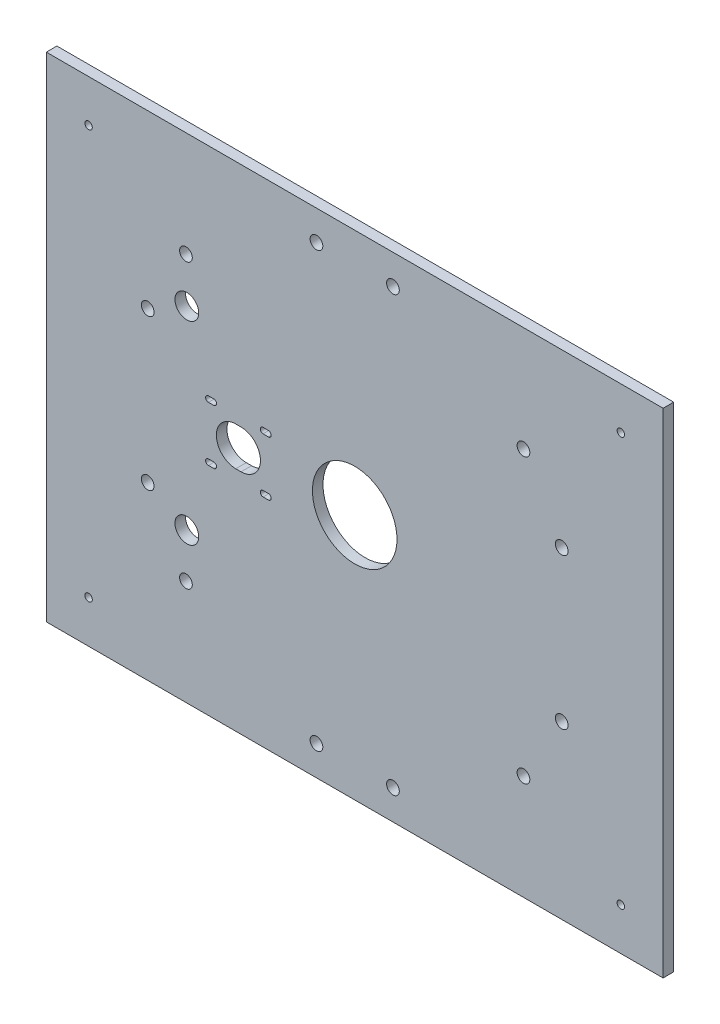
from build123d import *

# Parameters (mm, degrees)
ESBO_O1_W                    = 350
ESBO_O1_H                    = 280
RESSALTO_EXTRUS_O1_DEPTH     = 6
ESBO_O2_R                    = 24
CORTE_EXTRUS_O1_DEPTH        = 225.189651858
FUROS_GUIA_COM_8_0MM1_D      = 8
FURO_DE_DI_METRO_3_2_3_2_1_D = 3.2
FURO_COM_FOLGA_DE_M121_D     = 13.5
ESBO_O9_R                    = 3.6
CORTE_EXTRUS_O2_DEPTH        = 10
FURO_DE_DI_METRO_4_2_4_2_1_D = 4.2
CORTE_EXTRUS_O3_DEPTH        = 225.189651858


with BuildPart() as part:
    # Esboço1 → Ressalto-extrusão1 (new body)
    with BuildSketch(Plane.XY.offset(5)):
        Rectangle(ESBO_O1_W, ESBO_O1_H)
    extrude(amount=-RESSALTO_EXTRUS_O1_DEPTH)

    # Esboço2 → Corte-extrusão1 (cut, through all)
    with BuildSketch(Plane.XY.offset(5)):
        Circle(ESBO_O2_R)
    extrude(amount=-CORTE_EXTRUS_O1_DEPTH, mode=Mode.SUBTRACT)

    # Furos-guia com Ø8.0mm1 (through all)
    with Locations(Plane.XY.offset(5)):
        with Locations((-67.5, 0)):
            Hole(FUROS_GUIA_COM_8_0MM1_D / 2)

    # Furo de diâmetro Ø3.2 (3.2)1 (through all)
    with Locations(Plane.XY.offset(5)):
        with Locations((-83, 15.5), (-83, -15.5), (-52, 15.5), (-52, -15.5)):
            Hole(FURO_DE_DI_METRO_3_2_3_2_1_D / 2)

    # Furo com folga de M121 (through all)
    with Locations(Plane.XY.offset(5)):
        with Locations((-95.262794416, 55), (-95.262794416, -55)):
            Hole(FURO_COM_FOLGA_DE_M121_D / 2)

    # Esboço9 → Corte-extrusão2 (cut)
    with BuildSketch(Plane.XY.offset(5)):
        with Locations((-95.75555539, 80.348451211)):
            Circle(ESBO_O9_R)
        with Locations(Location((-117.461577598, 42.752517916, 0), (0, 0, 180))):
            Circle(ESBO_O9_R)
        with Locations((21.706022208, 123.100969127)):
            Circle(ESBO_O9_R)
        with Locations(Location((-21.706022208, 123.100969127, 0), (0, 0, 180))):
            Circle(ESBO_O9_R)
        with Locations((117.461577598, 42.752517916)):
            Circle(ESBO_O9_R)
        with Locations(Location((95.75555539, 80.348451211, 0), (0, 0, 180))):
            Circle(ESBO_O9_R)
        with Locations((95.75555539, -80.348451211)):
            Circle(ESBO_O9_R)
        with Locations(Location((117.461577598, -42.752517916, 0), (0, 0, 180))):
            Circle(ESBO_O9_R)
        with Locations((-21.706022208, -123.100969127)):
            Circle(ESBO_O9_R)
        with Locations(Location((21.706022208, -123.100969127, 0), (0, 0, 180))):
            Circle(ESBO_O9_R)
        with Locations((-117.461577598, -42.752517916)):
            Circle(ESBO_O9_R)
        with Locations(Location((-95.75555539, -80.348451211, 0), (0, 0, 180))):
            Circle(ESBO_O9_R)
    extrude(amount=-CORTE_EXTRUS_O2_DEPTH, mode=Mode.SUBTRACT)

    # Furo de diâmetro Ø4.2 (4.2)1 (through all)
    with Locations(Plane.XY.offset(5)):
        with Locations((-151, 116), (151, 116), (151, -116), (-151, -116)):
            Hole(FURO_DE_DI_METRO_4_2_4_2_1_D / 2)

    # Esboço12 → Corte-extrusão3 (cut, through all)
    with BuildSketch(Plane.XY.offset(5)):
        with BuildLine():
            Line((-67.5, 11), (-64.5, 11))
            ThreePointArc((-64.5, 11), (-53.5, 0), (-64.5, -11))
            Line((-64.5, -11), (-67.5, -11))
            ThreePointArc((-67.5, -11), (-78.5, 0), (-67.5, 11))
        make_face()
        with BuildLine():
            Line((-83, 17.1), (-80, 17.1))
            ThreePointArc((-80, 17.1), (-78.4, 15.5), (-80, 13.9))
            Line((-80, 13.9), (-83, 13.9))
            ThreePointArc((-83, 13.9), (-84.6, 15.5), (-83, 17.1))
        make_face()
        with BuildLine():
            Line((-83, -13.9), (-80, -13.9))
            ThreePointArc((-80, -13.9), (-78.4, -15.5), (-80, -17.1))
            Line((-80, -17.1), (-83, -17.1))
            ThreePointArc((-83, -17.1), (-84.6, -15.5), (-83, -13.9))
        make_face()
        with BuildLine():
            Line((-52, 17.1), (-49, 17.1))
            ThreePointArc((-49, 17.1), (-47.4, 15.5), (-49, 13.9))
            Line((-49, 13.9), (-52, 13.9))
            ThreePointArc((-52, 13.9), (-53.6, 15.5), (-52, 17.1))
        make_face()
        with BuildLine():
            Line((-52, -13.9), (-49, -13.9))
            ThreePointArc((-49, -13.9), (-47.4, -15.5), (-49, -17.1))
            Line((-49, -17.1), (-52, -17.1))
            ThreePointArc((-52, -17.1), (-53.6, -15.5), (-52, -13.9))
        make_face()
    extrude(amount=-CORTE_EXTRUS_O3_DEPTH, mode=Mode.SUBTRACT)


solid = part.part
